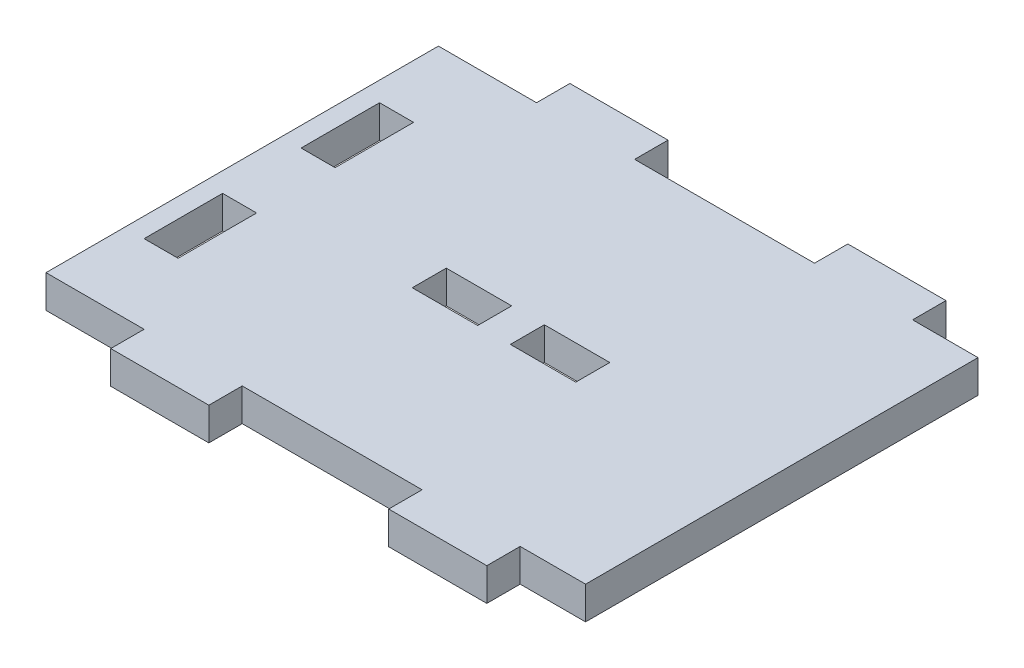
from build123d import *

# Parameters (mm, degrees)
SKETCH1_W           = 10
SKETCH1_H           = 5.2
SKETCH1_W_2         = 5.2
SKETCH1_H_2         = 12
BOSS_EXTRUDE1_DEPTH = 5


with BuildPart() as part:
    # Sketch1 → Boss-Extrude1 (new body)
    with BuildSketch(Plane(origin=(0, 0, 0), x_dir=(1, 0, 0), z_dir=(0, 1, 0))):
        Polygon((25, 30), (25, -30), (15, -30), (15, -35.1), (0, -35.1), (0, -30), (-27.5, -30), (-27.5, -35.1), (-42.5, -35.1), (-42.5, -30), (-57.5, -30), (-57.5, 30), (-42.5, 30), (-42.5, 35.1), (-27.5, 35.1), (-27.5, 30), (0, 30), (0, 35.1), (15, 35.1), (15, 30), align=None)
        with Locations((-22.5, -1.4)):
            Rectangle(SKETCH1_W, SKETCH1_H, mode=Mode.SUBTRACT)
        with Locations((-7.5, -1.4)):
            Rectangle(SKETCH1_W, SKETCH1_H, mode=Mode.SUBTRACT)
        with Locations((-51.9, -12)):
            Rectangle(SKETCH1_W_2, SKETCH1_H_2, mode=Mode.SUBTRACT)
        with Locations((-51.9, 12)):
            Rectangle(SKETCH1_W_2, SKETCH1_H_2, mode=Mode.SUBTRACT)
    extrude(amount=BOSS_EXTRUDE1_DEPTH)


solid = part.part
